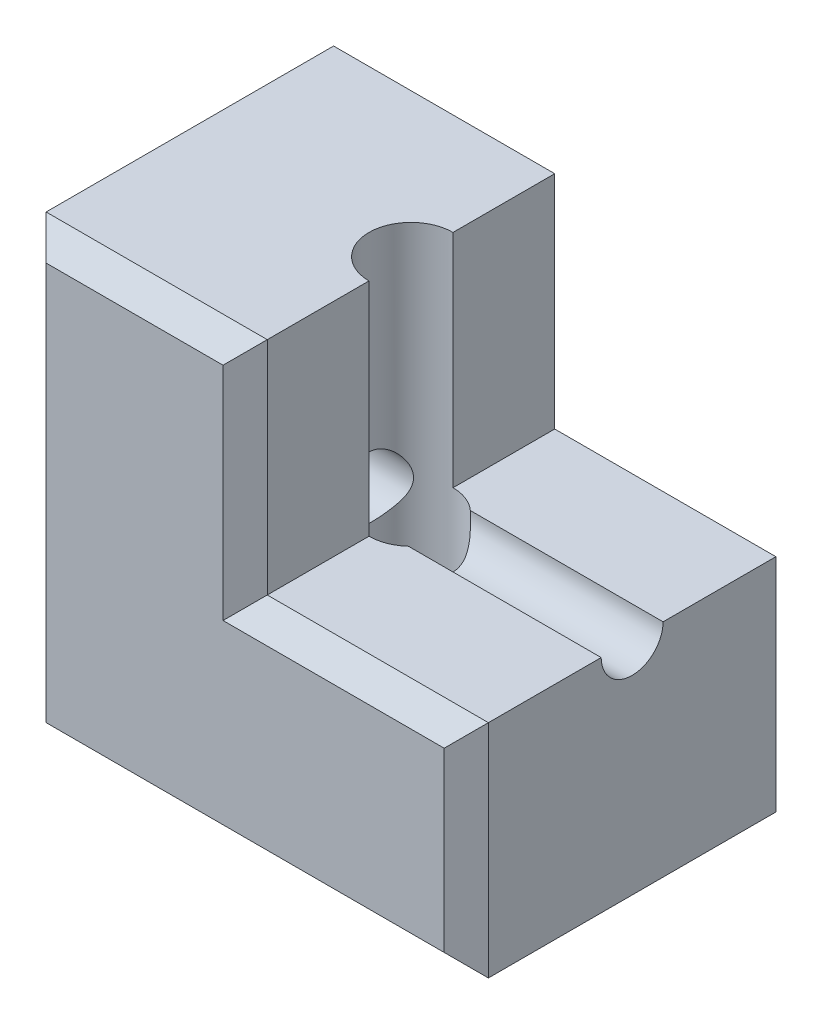
from build123d import *

# Parameters (mm, degrees)
BOSS_EXTRUDE2_DEPTH     = 15
SKETCH3_R               = 1.4
CUT_EXTRUDE1_DEPTH      = 33.015621187
CUT_EXTRUDE2_DEPTH      = 31.232432916
CUT_EXTRUDE2_DEPTH_BACK = 31.232432916
SKETCH4_R               = 1.9
CUT_EXTRUDE3_DEPTH      = 3
CHAMFER1_SIZE           = 1
CHAMFER2_SIZE           = 1
CHAMFER5_SIZE           = 1


with BuildPart() as part:
    # Sketch2 → Boss-Extrude2 (new body)
    with BuildSketch(Plane.XY):
        Polygon((0, 20), (0, 0), (20, 0), (20, 10), (10, 10), (10, 20), align=None)
    extrude(amount=BOSS_EXTRUDE2_DEPTH)

    # Sketch3 → Cut-Extrude1 (cut, through all)
    with BuildSketch(Plane.ZY):
        with Locations((7.5, 10)):
            Circle(SKETCH3_R)
    extrude(amount=-CUT_EXTRUDE1_DEPTH, mode=Mode.SUBTRACT)

    # Sketch4 → Cut-Extrude2 (cut, two sides: drawn at the far end of the back side and taken through both)
    with BuildSketch(Plane(origin=(0, 3, 0), x_dir=(-1, 0, 0), z_dir=(0, -1, 0)).offset(-CUT_EXTRUDE2_DEPTH_BACK)):
        with Locations(Location((-10, -7.5, 0), (0, 0, 90))):
            Circle(SKETCH4_R)
    extrude(amount=CUT_EXTRUDE2_DEPTH + CUT_EXTRUDE2_DEPTH_BACK, mode=Mode.SUBTRACT)

    # Sketch5 → Cut-Extrude3 (cut)
    with BuildSketch(Plane(origin=(0, 3, 0), x_dir=(-1, 0, 0), z_dir=(0, -1, 0))):
        Polygon((-12.75, -3), (-13.553847577, 0), (-6.446152423, 0), (-7.25, -3), (-7.25, -12), (-12.75, -12), align=None)
    extrude(amount=-CUT_EXTRUDE3_DEPTH, mode=Mode.SUBTRACT)

    # Chamfer1
    chamfer1_edges = [part.edges().sort_by_distance(p)[0] for p in [
        (10, 3, 0),
        (10, 6, 0),
    ]]
    chamfer(chamfer1_edges, length=CHAMFER1_SIZE)

    # Chamfer2
    chamfer2_edges = [part.edges().sort_by_distance(p)[0] for p in [
        (10, 0, 15),
        (20, 5, 15),
        (15, 10, 15),
        (10, 15, 15),
        (5, 20, 15),
        (0, 10, 15),
    ]]
    chamfer(chamfer2_edges, length=CHAMFER2_SIZE)

    # Chamfer5
    chamfer5_edges = [part.edges().sort_by_distance(p)[0] for p in [
        (10, 15, 0),
        (15, 10, 0),
        (20, 5, 0),
        (10, 0, 0),
        (0, 10, 0),
        (5, 20, 0),
    ]]
    chamfer(chamfer5_edges, length=CHAMFER5_SIZE)


solid = part.part
